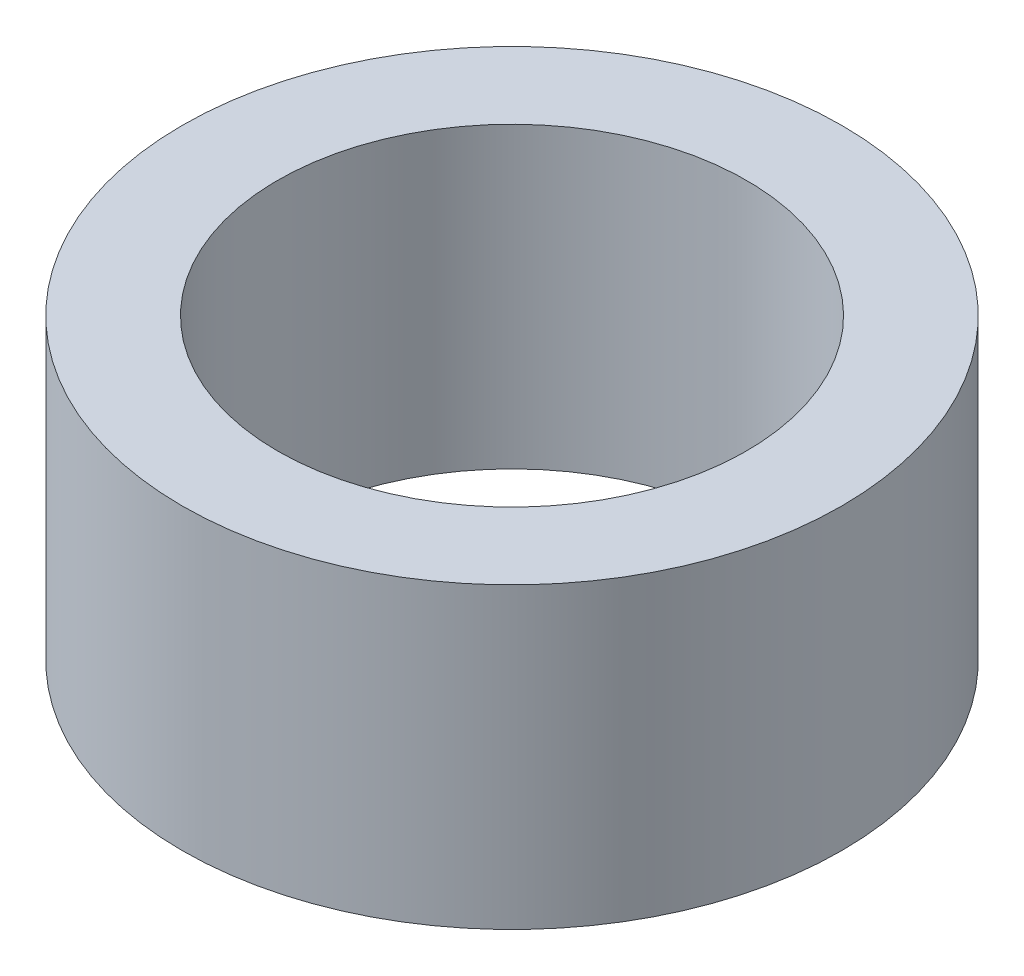
from build123d import *

# Parameters (mm, degrees)
SKETCH1_R           = 2.25
SKETCH1_R_2         = 1.6
BOSS_EXTRUDE1_DEPTH = 2.037


with BuildPart() as part:
    # Sketch1 → Boss-Extrude1 (new body)
    with BuildSketch(Plane(origin=(0, 0, 0), x_dir=(1, 0, 0), z_dir=(0, 1, 0))):
        with Locations(Location((0, 0, 0), (0, 0, 270))):
            Circle(SKETCH1_R)
        with Locations(Location((0, 0, 0), (0, 0, 270))):
            Circle(SKETCH1_R_2, mode=Mode.SUBTRACT)
    extrude(amount=BOSS_EXTRUDE1_DEPTH)


solid = part.part
